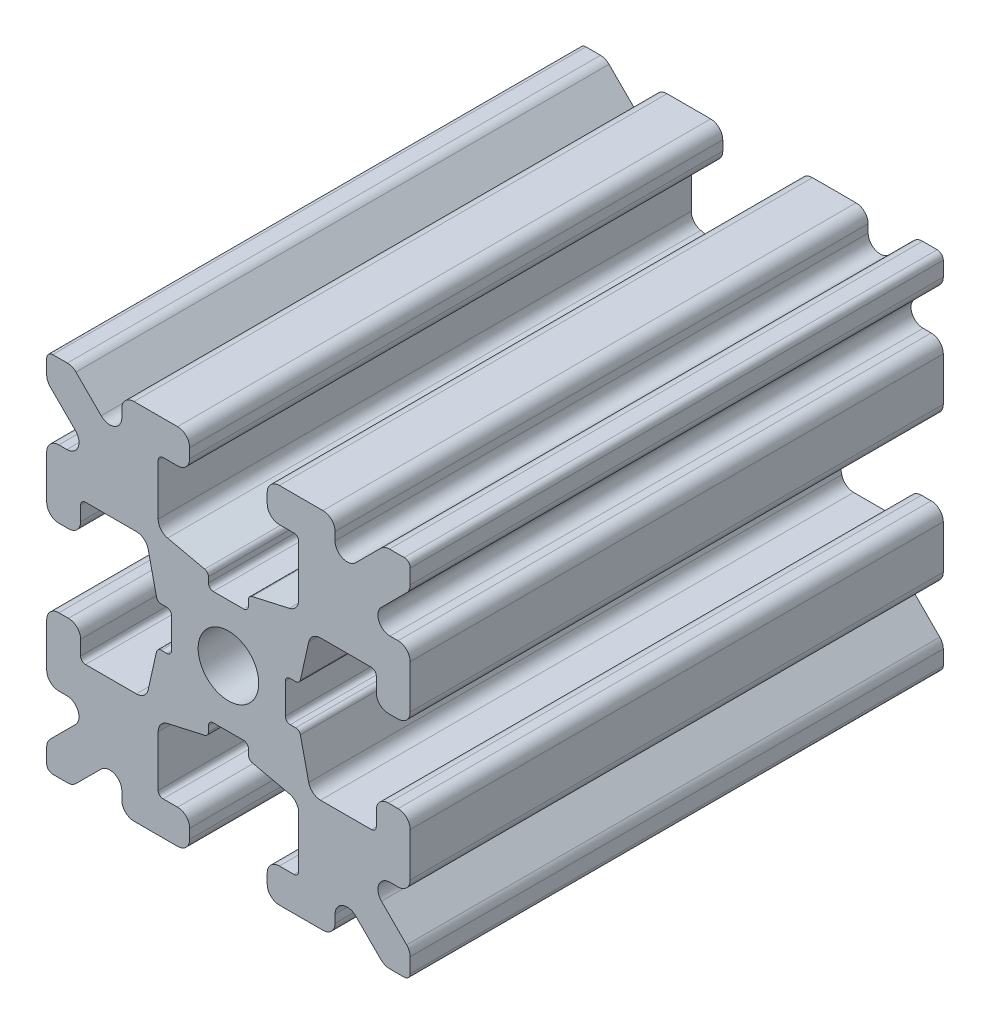
from build123d import *

# Parameters (mm, degrees)
SKETCH1_W           = 15
SKETCH1_H           = 15
SKETCH1_R           = 1.25
BOSS_EXTRUDE1_DEPTH = 11
FILLET1_R           = 0.25
CUT_EXTRUDE1_DEPTH  = 25.423349484
CUT_EXTRUDE3_DEPTH  = 25.423349484
FILLET3_R           = 0.5
FILLET4_R           = 0.5
FILLET5_R           = 3
FILLET6_R           = 0.2
CUT_EXTRUDE4_DEPTH  = 25.423349484
FILLET8_R           = 0.5
SKETCH6_W           = 5.1529354
SKETCH6_H           = 1.651
SKETCH6_W_2         = 1.651
SKETCH6_H_2         = 5.1529354
CUT_EXTRUDE5_DEPTH  = 25.423349484
FILLET10_R          = 0.2


with BuildPart() as part:
    # Sketch1 → Boss-Extrude1 (new, symmetric)
    with BuildSketch(Plane.XY):
        Rectangle(SKETCH1_W, SKETCH1_H)
        Circle(SKETCH1_R, mode=Mode.SUBTRACT)
    extrude(amount=BOSS_EXTRUDE1_DEPTH, both=True)

    # Fillet1
    fillet1_edges = [part.edges().sort_by_distance(p)[0] for p in [
        (7.5, -7.5, 0),
        (-7.5, -7.5, 0),
        (-7.5, 7.5, 0),
        (7.5, 7.5, 0),
    ]]
    fillet(fillet1_edges, radius=FILLET1_R)

    # Sketch2 → Cut-Extrude1 (cut, through all)
    with BuildSketch(Plane.XY.offset(11)):
        Polygon((-7.5, 1.6), (-6.1, 1.6), (-6.1, 2.9), (-3.4, 2.9), (-3.4, -2.9), (-6.1, -2.9), (-6.1, -1.6), (-7.5, -1.6), align=None)
        Polygon((2.9, 6.1), (1.6, 6.1), (1.6, 7.5), (-1.6, 7.5), (-1.6, 6.1), (-2.9, 6.1), (-2.9, 3.4), (2.9, 3.4), align=None)
        Polygon((-1.6, -7.5), (-1.6, -6.1), (-2.9, -6.1), (-2.9, -3.4), (2.9, -3.4), (2.9, -6.1), (1.6, -6.1), (1.6, -7.5), align=None)
        Polygon((6.1, -2.9), (6.1, -1.6), (7.5, -1.6), (7.5, 1.6), (6.1, 1.6), (6.1, 2.9), (3.4, 2.9), (3.4, -2.9), align=None)
    extrude(amount=-CUT_EXTRUDE1_DEPTH, mode=Mode.SUBTRACT)

    # Sketch4 → Cut-Extrude3 (cut, through all)
    with BuildSketch(Plane.XY.offset(11)):
        Polygon((-3.4, 2.9), (-2.75, 0), (-3.4, -2.9), align=None)
        Polygon((-2.9, 3.4), (0, 2.75), (2.9, 3.4), align=None)
        Polygon((3.4, 2.9), (2.75, 0), (3.4, -2.9), align=None)
        Polygon((-2.9, -3.4), (0, -2.75), (2.9, -3.4), align=None)
    extrude(amount=-CUT_EXTRUDE3_DEPTH, mode=Mode.SUBTRACT)

    # Fillet3
    fillet3_edges = [part.edges().sort_by_distance(p)[0] for p in [
        (1.6, -7.5, 0),
        (-1.6, -7.5, 0),
        (-1.6, -6.1, 0),
        (1.6, -6.1, 0),
        (6.1, 1.6, 0),
        (7.5, 1.6, 0),
        (7.5, -1.6, 0),
        (6.1, -1.6, 0),
        (-7.5, -1.6, 0),
        (-7.5, 1.6, 0),
        (-6.1, 1.6, 0),
        (-6.1, -1.6, 0),
        (-1.6, 6.1, 0),
        (-1.6, 7.5, 0),
        (1.6, 7.5, 0),
        (1.6, 6.1, 0),
    ]]
    fillet(fillet3_edges, radius=FILLET3_R)

    # Fillet4
    fillet4_edges = [part.edges().sort_by_distance(p)[0] for p in [
        (-2.9, -3.4, 0),
        (2.9, -3.4, 0),
        (3.4, -2.9, 0),
        (3.4, 2.9, 0),
        (-3.4, 2.9, 0),
        (-3.4, -2.9, 0),
        (2.9, 3.4, 0),
        (-2.9, 3.4, 0),
    ]]
    fillet(fillet4_edges, radius=FILLET4_R)

    # Fillet5
    fillet5_edges = [part.edges().sort_by_distance(p)[0] for p in [
        (-2.75, 0, 0),
        (0, 2.75, 0),
        (2.75, 0, 0),
        (0, -2.75, 0),
    ]]
    fillet(fillet5_edges, radius=FILLET5_R)

    # Fillet6
    fillet6_edges = [part.edges().sort_by_distance(p)[0] for p in [
        (-2.9, -6.1, 0),
        (2.9, -6.1, 0),
        (6.1, -2.9, 0),
        (6.1, 2.9, 0),
        (-6.1, 2.9, 0),
        (-6.1, -2.9, 0),
        (2.9, 6.1, 0),
        (-2.9, 6.1, 0),
    ]]
    fillet(fillet6_edges, radius=FILLET6_R)

    # Sketch5 → Cut-Extrude4 (cut, through all)
    with BuildSketch(Plane.XY.offset(11)):
        Polygon((-7.5, 6.439339828), (-5.460660172, 4.4), (-7.5, 4.4), align=None)
        Polygon((-6.439339828, 7.5), (-4.4, 5.460660172), (-4.4, 7.5), align=None)
        Polygon((4.4, 7.5), (6.439339828, 7.5), (4.4, 5.460660172), align=None)
        Polygon((7.5, 6.439339828), (7.5, 4.4), (5.460660172, 4.4), align=None)
        Polygon((7.5, -6.439339828), (5.460660172, -4.4), (7.5, -4.4), align=None)
        Polygon((6.439339828, -7.5), (4.4, -5.460660172), (4.4, -7.5), align=None)
        Polygon((-4.4, -7.5), (-6.439339828, -7.5), (-4.4, -5.460660172), align=None)
        Polygon((-7.5, -6.439339828), (-7.5, -4.4), (-5.460660172, -4.4), align=None)
    extrude(amount=-CUT_EXTRUDE4_DEPTH, mode=Mode.SUBTRACT)

    # Fillet8
    fillet8_edges = [part.edges().sort_by_distance(p)[0] for p in [
        (-7.5, 4.4, 0),
        (-7.5, 6.439339828, 0),
        (-5.460660172, 4.4, 0),
        (7.5, -4.4, 0),
        (7.5, -6.439339828, 0),
        (5.460660172, -4.4, 0),
        (5.460660172, 4.4, 0),
        (7.5, 6.439339828, 0),
        (7.5, 4.4, 0),
        (-4.4, 7.5, 0),
        (-4.4, 5.460660172, 0),
        (-6.439339828, 7.5, 0),
        (-5.460660172, -4.4, 0),
        (-7.5, -6.439339828, 0),
        (-7.5, -4.4, 0),
        (4.4, 5.460660172, 0),
        (4.4, 7.5, 0),
        (6.439339828, 7.5, 0),
        (6.439339828, -7.5, 0),
        (4.4, -7.5, 0),
        (4.4, -5.460660172, 0),
        (-6.439339828, -7.5, 0),
        (-4.4, -5.460660172, 0),
        (-4.4, -7.5, 0),
    ]]
    fillet(fillet8_edges, radius=FILLET8_R)

    # Sketch6 → Cut-Extrude5 (cut, through all)
    with BuildSketch(Plane.XY.offset(11)):
        with Locations((4.9235323, 0)):
            Rectangle(SKETCH6_W, SKETCH6_H)
        with Locations((0, -4.9235323)):
            Rectangle(SKETCH6_W_2, SKETCH6_H_2)
        with Locations((-4.9235323, 0)):
            Rectangle(SKETCH6_W, SKETCH6_H)
        with Locations((0, 4.9235323)):
            Rectangle(SKETCH6_W_2, SKETCH6_H_2)
    extrude(amount=-CUT_EXTRUDE5_DEPTH, mode=Mode.SUBTRACT)

    # Fillet10
    fillet10_edges = [part.edges().sort_by_distance(p)[0] for p in [
        (0.8255, -2.935025862, 0),
        (-0.8255, -2.935025862, 0),
        (0.8255, -2.3470646, 0),
        (-0.8255, -2.3470646, 0),
        (2.935025862, 0.8255, 0),
        (2.935025862, -0.8255, 0),
        (2.3470646, 0.8255, 0),
        (2.3470646, -0.8255, 0),
        (-2.935025862, -0.8255, 0),
        (-2.935025862, 0.8255, 0),
        (-2.3470646, -0.8255, 0),
        (-2.3470646, 0.8255, 0),
        (-0.8255, 2.935025862, 0),
        (0.8255, 2.935025862, 0),
        (-0.8255, 2.3470646, 0),
        (0.8255, 2.3470646, 0),
    ]]
    fillet(fillet10_edges, radius=FILLET10_R)


solid = part.part
